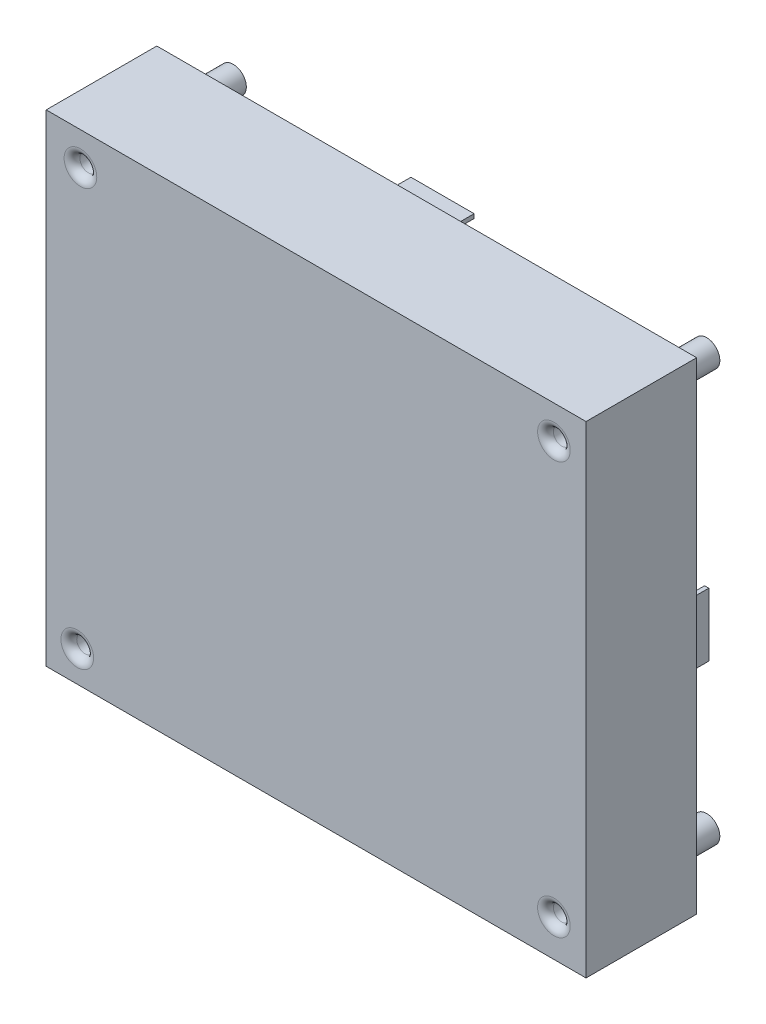
from build123d import *

# Parameters (mm, degrees)
SKETCH_1_W          = 102.5
SKETCH_1_H          = 91.5
EXTRUDE_1_DEPTH     = 21
SKETCH_2_W          = 99.5
SKETCH_2_H          = 89
CUT_EXTRUDE_1_DEPTH = 19
SKETCH_3_W          = 55
SKETCH_3_H          = 1.25
CUT_EXTRUDE_2_DEPTH = 3
SKETCH_8_R          = 1.6
EXTRUDE_2_DEPTH     = 0.1
SKETCH_9_R          = 2.5
EXTRUDE_3_DEPTH     = 27
SKETCH_12_R         = 1.6
CUT_EXTRUDE_4_DEPTH = 29
FILLET_6_R          = 1.5
SKETCH_10_W         = 0.8
SKETCH_10_H         = 12
SKETCH_10_W_2       = 12
SKETCH_10_H_2       = 0.8
EXTRUDE_4_DEPTH     = 3
FILLET_7_R          = 1.5


with BuildPart() as part:
    # Эскиз1 → Бобышка-Вытянуть1 (new body)
    with BuildSketch(Plane.XY):
        Rectangle(SKETCH_1_W, SKETCH_1_H)
    extrude(amount=-EXTRUDE_1_DEPTH)

    # Эскиз2 → Вырез-Вытянуть1 (cut)
    with BuildSketch(Plane(origin=(0, 0, -21), x_dir=(-1, 0, 0), z_dir=(0, 0, -1))):
        Rectangle(SKETCH_2_W, SKETCH_2_H)
    extrude(amount=-CUT_EXTRUDE_1_DEPTH, mode=Mode.SUBTRACT)

    # Эскиз3 → Вырез-Вытянуть2 (cut)
    with BuildSketch(Plane(origin=(0, 0, -21), x_dir=(-1, 0, 0), z_dir=(0, 0, -1))):
        with Locations((-10.25, -45.125)):
            Rectangle(SKETCH_3_W, SKETCH_3_H)
    extrude(amount=-CUT_EXTRUDE_2_DEPTH, mode=Mode.SUBTRACT)

    # Эскиз8 → Бобышка-Вытянуть2 (add)
    with BuildSketch(Plane(origin=(0, 0, -2), x_dir=(-1, 0, 0), z_dir=(0, 0, -1))):
        with Locations((-45.15, 39.5)):
            Circle(SKETCH_8_R)
        with Locations((44.75, 39.5)):
            Circle(SKETCH_8_R)
        with Locations((-45.15, -38.75)):
            Circle(SKETCH_8_R)
        with Locations((45.35, -39.9)):
            Circle(SKETCH_8_R)
    extrude(amount=EXTRUDE_2_DEPTH)

    # Эскиз9 → Бобышка-Вытянуть3 (add)
    with BuildSketch(Plane(origin=(0, 0, -2), x_dir=(-1, 0, 0), z_dir=(0, 0, -1))):
        with Locations((-45.15, 39.5)):
            Circle(SKETCH_9_R)
        with Locations((44.75, 39.5)):
            Circle(SKETCH_9_R)
        with Locations((-45.15, -38.75)):
            Circle(SKETCH_9_R)
        with Locations((45.35, -39.9)):
            Circle(SKETCH_9_R)
    extrude(amount=EXTRUDE_3_DEPTH)

    # Эскиз12 → Вырез-Вытянуть4 (cut)
    with BuildSketch(Plane(origin=(0, 0, -29), x_dir=(-1, 0, 0), z_dir=(0, 0, -1))):
        with Locations((-45.15, 39.5)):
            Circle(SKETCH_12_R)
        with Locations((44.75, 39.5)):
            Circle(SKETCH_12_R)
        with Locations((-45.15, -38.75)):
            Circle(SKETCH_12_R)
        with Locations((45.35, -39.9)):
            Circle(SKETCH_12_R)
    extrude(amount=-CUT_EXTRUDE_4_DEPTH, mode=Mode.SUBTRACT)

    # Скругление6
    fillet_6_edges = [part.edges().sort_by_distance(p)[0] for p in [
        (47.65, 39.5, -2),
        (-42.25, 39.5, -2),
        (47.65, -38.75, -2),
        (-42.85, -39.9, -2),
    ]]
    fillet(fillet_6_edges, radius=FILLET_6_R)

    # Эскиз10 → Бобышка-Вытянуть4 (add)
    with BuildSketch(Plane(origin=(0, 0, -21), x_dir=(-1, 0, 0), z_dir=(0, 0, -1))):
        with Locations((-50.15, 0)):
            Rectangle(SKETCH_10_W, SKETCH_10_H)
        with Locations((0, 44.9)):
            Rectangle(SKETCH_10_W_2, SKETCH_10_H_2)
        with Locations((50.15, 0)):
            Rectangle(SKETCH_10_W, SKETCH_10_H)
    extrude(amount=EXTRUDE_4_DEPTH)

    # Скругление7
    fillet_7_edges = [part.edges().sort_by_distance(p)[0] for p in [
        (-43.15, 39.5, 0),
        (46.75, -38.75, 0),
        (-43.75, -39.9, 0),
        (46.75, 39.5, 0),
    ]]
    fillet(fillet_7_edges, radius=FILLET_7_R)


solid = part.part
